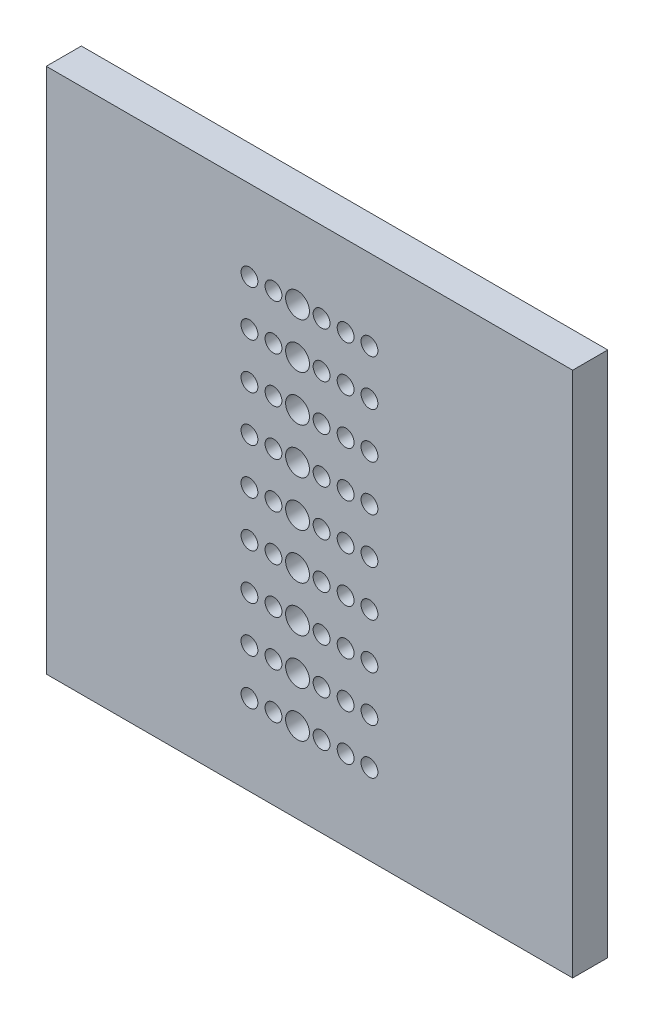
from build123d import *

# Parameters (mm, degrees)
ESQUISSE2_W             = 30
ESQUISSE2_H             = 30
BOSS_EXTRU_1_DEPTH      = 2
ESQUISSE3_R             = 0.48
ESQUISSE3_R_2           = 0.68
ENL_V_MAT_EXTRU_1_DEPTH = 10


with BuildPart() as part:
    # Esquisse2 → Boss.-Extru.1 (new body)
    with BuildSketch(Plane.XY):
        Rectangle(ESQUISSE2_W, ESQUISSE2_H)
    extrude(amount=BOSS_EXTRU_1_DEPTH)

    # Esquisse3 → Enlèv. mat.-Extru.1 (cut)
    with BuildSketch(Plane.XY.offset(2)):
        with Locations((-3.42, -10.4)):
            Circle(ESQUISSE3_R)
        with Locations((-3.42, -7.8)):
            Circle(ESQUISSE3_R)
        with Locations((-3.42, -5.2)):
            Circle(ESQUISSE3_R)
        with Locations((-3.42, -2.6)):
            Circle(ESQUISSE3_R)
        with Locations((-3.42, 0)):
            Circle(ESQUISSE3_R)
        with Locations((-3.42, 2.6)):
            Circle(ESQUISSE3_R)
        with Locations((-3.42, 5.2)):
            Circle(ESQUISSE3_R)
        with Locations((-3.42, 7.8)):
            Circle(ESQUISSE3_R)
        with Locations((-3.42, 10.4)):
            Circle(ESQUISSE3_R)
        with Locations((-2.05, -10.4)):
            Circle(ESQUISSE3_R)
        with Locations((-2.05, -7.8)):
            Circle(ESQUISSE3_R)
        with Locations((-2.05, -5.2)):
            Circle(ESQUISSE3_R)
        with Locations((-2.05, -2.6)):
            Circle(ESQUISSE3_R)
        with Locations((-2.05, 0)):
            Circle(ESQUISSE3_R)
        with Locations((-2.05, 2.6)):
            Circle(ESQUISSE3_R)
        with Locations((-2.05, 5.2)):
            Circle(ESQUISSE3_R)
        with Locations((-2.05, 7.8)):
            Circle(ESQUISSE3_R)
        with Locations((-2.05, 10.4)):
            Circle(ESQUISSE3_R)
        with Locations((-0.68, -10.4)):
            Circle(ESQUISSE3_R_2)
        with Locations((-0.68, -7.8)):
            Circle(ESQUISSE3_R_2)
        with Locations((-0.68, -5.2)):
            Circle(ESQUISSE3_R_2)
        with Locations((-0.68, -2.6)):
            Circle(ESQUISSE3_R_2)
        with Locations((-0.68, 0)):
            Circle(ESQUISSE3_R_2)
        with Locations((-0.68, 2.6)):
            Circle(ESQUISSE3_R_2)
        with Locations((-0.68, 5.2)):
            Circle(ESQUISSE3_R_2)
        with Locations((-0.68, 7.8)):
            Circle(ESQUISSE3_R_2)
        with Locations((-0.68, 10.4)):
            Circle(ESQUISSE3_R_2)
        with Locations((0.69, -10.4)):
            Circle(ESQUISSE3_R)
        with Locations((0.69, -7.8)):
            Circle(ESQUISSE3_R)
        with Locations((0.69, -5.2)):
            Circle(ESQUISSE3_R)
        with Locations((0.69, -2.6)):
            Circle(ESQUISSE3_R)
        with Locations((0.69, 0)):
            Circle(ESQUISSE3_R)
        with Locations((0.69, 2.6)):
            Circle(ESQUISSE3_R)
        with Locations((0.69, 5.2)):
            Circle(ESQUISSE3_R)
        with Locations((0.69, 7.8)):
            Circle(ESQUISSE3_R)
        with Locations((0.69, 10.4)):
            Circle(ESQUISSE3_R)
        with Locations((2.06, -10.4)):
            Circle(ESQUISSE3_R)
        with Locations((2.06, -7.8)):
            Circle(ESQUISSE3_R)
        with Locations((2.06, -5.2)):
            Circle(ESQUISSE3_R)
        with Locations((2.06, -2.6)):
            Circle(ESQUISSE3_R)
        with Locations((2.06, 0)):
            Circle(ESQUISSE3_R)
        with Locations((2.06, 2.6)):
            Circle(ESQUISSE3_R)
        with Locations((2.06, 5.2)):
            Circle(ESQUISSE3_R)
        with Locations((2.06, 7.8)):
            Circle(ESQUISSE3_R)
        with Locations((2.06, 10.4)):
            Circle(ESQUISSE3_R)
        with Locations((3.42, -10.4)):
            Circle(ESQUISSE3_R)
        with Locations((3.42, -7.8)):
            Circle(ESQUISSE3_R)
        with Locations((3.42, -5.2)):
            Circle(ESQUISSE3_R)
        with Locations((3.42, -2.6)):
            Circle(ESQUISSE3_R)
        with Locations((3.42, 0)):
            Circle(ESQUISSE3_R)
        with Locations((3.42, 2.6)):
            Circle(ESQUISSE3_R)
        with Locations((3.42, 5.2)):
            Circle(ESQUISSE3_R)
        with Locations((3.42, 7.8)):
            Circle(ESQUISSE3_R)
        with Locations((3.42, 10.4)):
            Circle(ESQUISSE3_R)
    extrude(amount=-ENL_V_MAT_EXTRU_1_DEPTH, mode=Mode.SUBTRACT)


solid = part.part
